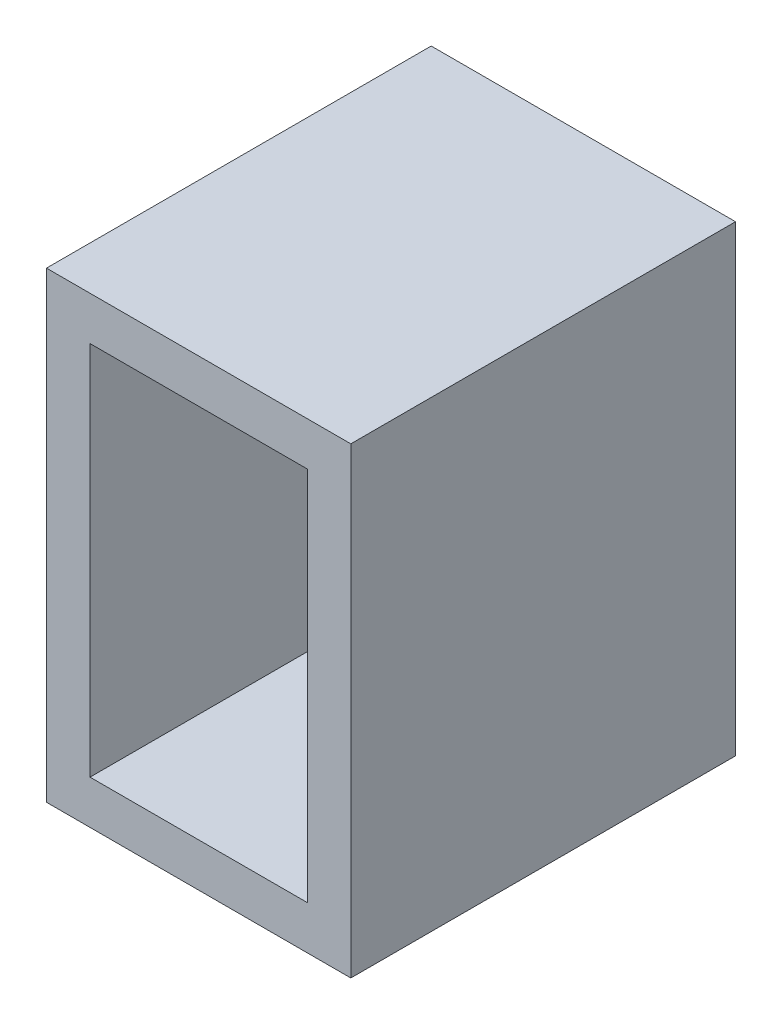
from build123d import *

# Parameters (mm, degrees)
CROQUIS1_W              = 22.15
CROQUIS1_H              = 33.67
SALIENTE_EXTRUIR1_DEPTH = 28
CROQUIS2_W              = 15.81
CROQUIS2_H              = 27.33
CORTAR_EXTRUIR1_DEPTH   = 25


with BuildPart() as part:
    # Croquis1 → Saliente-Extruir1 (new body)
    with BuildSketch(Plane.XY):
        with Locations((1.105857743, 10.112280702)):
            Rectangle(CROQUIS1_W, CROQUIS1_H)
    extrude(amount=SALIENTE_EXTRUIR1_DEPTH)

    # Croquis2 → Cortar-Extruir1 (cut)
    with BuildSketch(Plane.XY.offset(28)):
        with Locations((1.105857743, 10.112280702)):
            Rectangle(CROQUIS2_W, CROQUIS2_H)
    extrude(amount=-CORTAR_EXTRUIR1_DEPTH, mode=Mode.SUBTRACT)


solid = part.part
